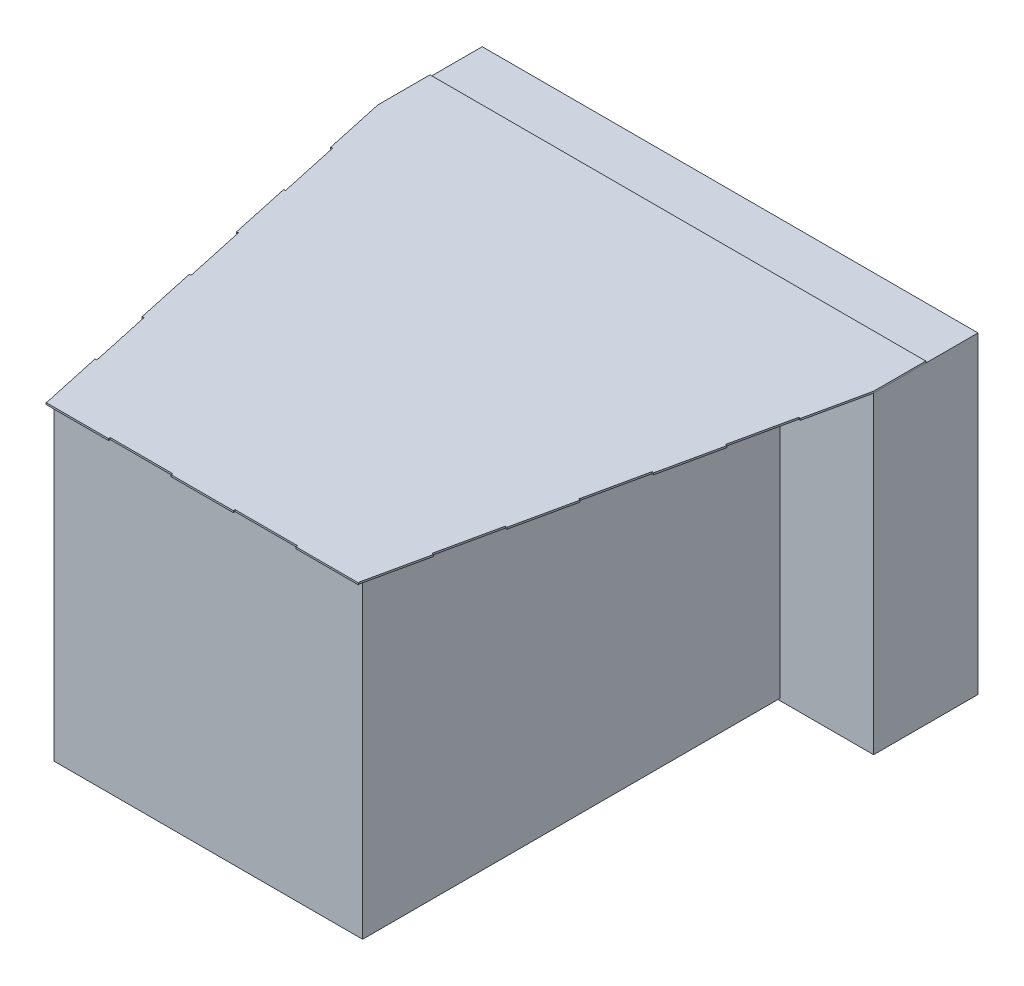
from build123d import *

# Parameters (mm, degrees)
SKETCH_1_W          = 570
SKETCH_1_H          = 360
EXTRUDE_1_DEPTH     = 120
SKETCH_2_W          = 530
SKETCH_2_H          = 345
CUT_EXTRUDE_1_DEPTH = 100
SKETCH_4_W          = 355
SKETCH_4_H          = 355
EXTRUDE_2_DEPTH     = 480
EXTRUDE_3_DEPTH     = 2


with BuildPart() as part:
    # ｽｹｯﾁ1 → ﾎﾞｽ - 押し出し1 (new body)
    with BuildSketch(Plane.XY):
        with Locations((0, 180)):
            Rectangle(SKETCH_1_W, SKETCH_1_H)
    extrude(amount=EXTRUDE_1_DEPTH)

    # ｽｹｯﾁ2 → ｶｯﾄ - 押し出し1 (cut)
    with BuildSketch(Plane(origin=(0, 0, 0), x_dir=(-1, 0, 0), z_dir=(0, 0, -1))):
        with Locations((0, 172.5)):
            Rectangle(SKETCH_2_W, SKETCH_2_H)
    extrude(amount=-CUT_EXTRUDE_1_DEPTH, mode=Mode.SUBTRACT)


with BuildPart() as body_2:
    # ｽｹｯﾁ4 → ﾎﾞｽ - 押し出し2 (new body)
    with BuildSketch(Plane.XY.offset(120)):
        with Locations((0, 180)):
            Rectangle(SKETCH_4_W, SKETCH_4_H)
    extrude(amount=EXTRUDE_2_DEPTH)


with BuildPart() as body_3:
    # ｽｹｯﾁ6 → ﾎﾞｽ - 押し出し3 (new body)
    with BuildSketch(Plane(origin=(0, 360, 0), x_dir=(1, 0, 0), z_dir=(0, 1, 0))):
        Polygon((-285, -60), (285, -60), (285, -120), (269.928571429, -189.285714286), (267.974273268, -188.860604067), (252.902844696, -258.146318353), (254.857142857, -258.571428571), (239.785714286, -327.857142857), (237.831416125, -327.432032639), (222.759987553, -396.717746924), (224.714285714, -397.142857143), (209.642857143, -466.428571429), (207.688558982, -466.00346121), (192.61713041, -535.289175496), (194.571428571, -535.714285714), (179.5, -605), (179.5, -607), (107.7, -607), (107.7, -605), (35.9, -605), (35.9, -607), (-35.9, -607), (-35.9, -605), (-107.7, -605), (-107.7, -607), (-179.5, -607), (-179.5, -605), (-194.571428571, -535.714285714), (-192.61713041, -535.289175496), (-207.688558982, -466.00346121), (-209.642857143, -466.428571429), (-224.714285714, -397.142857143), (-222.759987553, -396.717746924), (-237.831416125, -327.432032639), (-239.785714286, -327.857142857), (-254.857142857, -258.571428571), (-252.902844696, -258.146318353), (-267.974273268, -188.860604067), (-269.928571429, -189.285714286), (-285, -120), align=None)
    extrude(amount=EXTRUDE_3_DEPTH)


solid = Compound([part.part, body_2.part, body_3.part])
